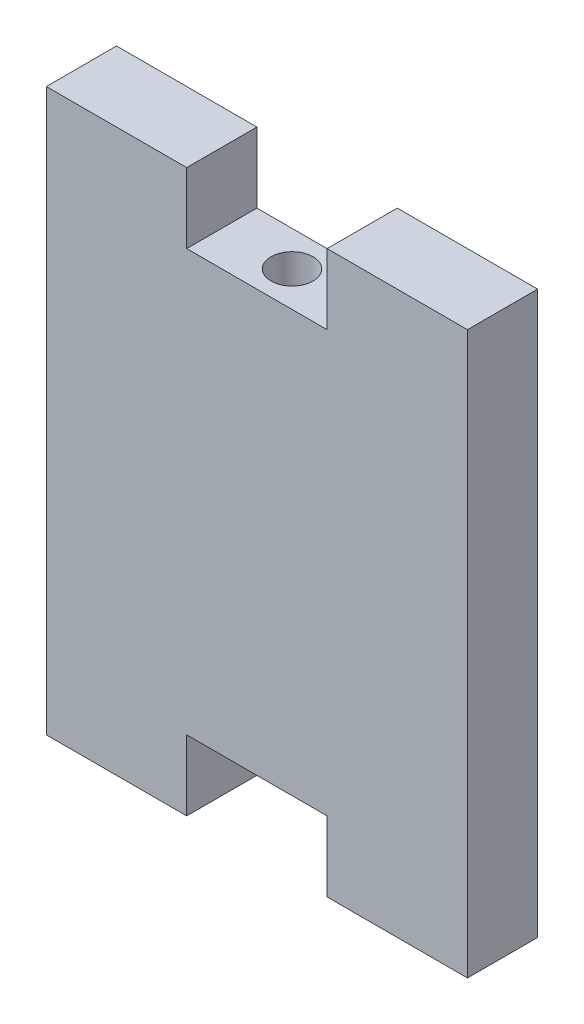
from build123d import *

# Parameters (mm, degrees)
BOSS_EXTRUDE1_DEPTH = 10
SKETCH2_R           = 3
CUT_EXTRUDE2_DEPTH  = 77.811457479


with BuildPart() as part:
    # Sketch1 → Boss-Extrude1 (new body)
    with BuildSketch(Plane.XY):
        Polygon((10, 40), (30, 40), (30, -40), (10, -40), (10, -30), (-10, -30), (-10, -40), (-30, -40), (-30, 40), (-10, 40), (-10, 30), (10, 30), align=None)
    extrude(amount=BOSS_EXTRUDE1_DEPTH)

    # Sketch2 → Cut-Extrude2 (cut, through all)
    with BuildSketch(Plane(origin=(0, 30, 0), x_dir=(1, 0, 0), z_dir=(0, 1, 0))):
        with Locations(Location((0, -5, 0), (0, 0, 270))):
            Circle(SKETCH2_R)
    extrude(amount=-CUT_EXTRUDE2_DEPTH, mode=Mode.SUBTRACT)


solid = part.part
